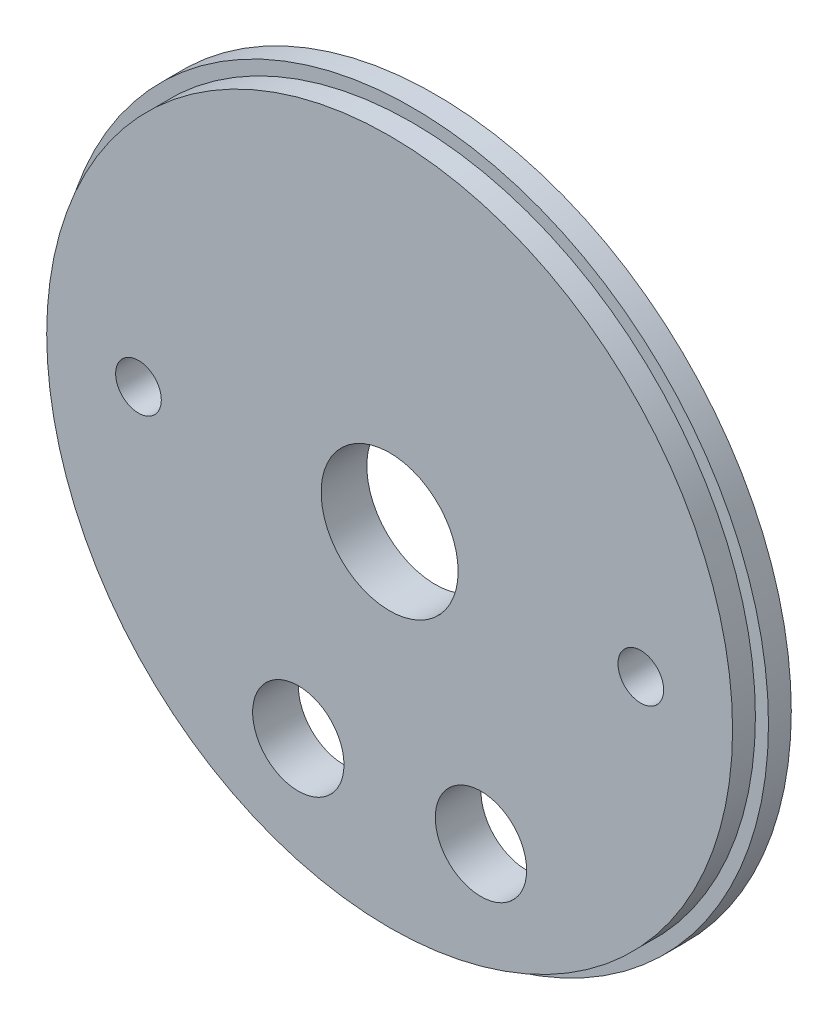
from build123d import *

# Parameters (mm, degrees)
SKETCH1_R           = 49.5046
BOSS_EXTRUDE1_DEPTH = 3.175
SKETCH2_R           = 47.6885
BOSS_EXTRUDE2_DEPTH = 3.175
SKETCH3_R           = 6.35
SKETCH3_R_2         = 3.175
SKETCH3_R_3         = 9.525
CUT_EXTRUDE1_DEPTH  = 71.297463271


with BuildPart() as part:
    # Sketch1 → Boss-Extrude1 (new body)
    with BuildSketch(Plane.XY):
        Circle(SKETCH1_R)
    extrude(amount=BOSS_EXTRUDE1_DEPTH)

    # Sketch2 → Boss-Extrude2 (add)
    with BuildSketch(Plane.XY.offset(3.175)):
        Circle(SKETCH2_R)
    extrude(amount=BOSS_EXTRUDE2_DEPTH)

    # Sketch3 → Cut-Extrude1 (cut, through all)
    with BuildSketch(Plane.XY.offset(6.35)):
        with Locations((-12.7, -31.235352443)):
            Circle(SKETCH3_R)
        with Locations((12.7, -31.235352443)):
            Circle(SKETCH3_R)
        with Locations((-34.925, 0)):
            Circle(SKETCH3_R_2)
        with Locations((34.925, 0)):
            Circle(SKETCH3_R_2)
        Circle(SKETCH3_R_3)
    extrude(amount=-CUT_EXTRUDE1_DEPTH, mode=Mode.SUBTRACT)


solid = part.part
